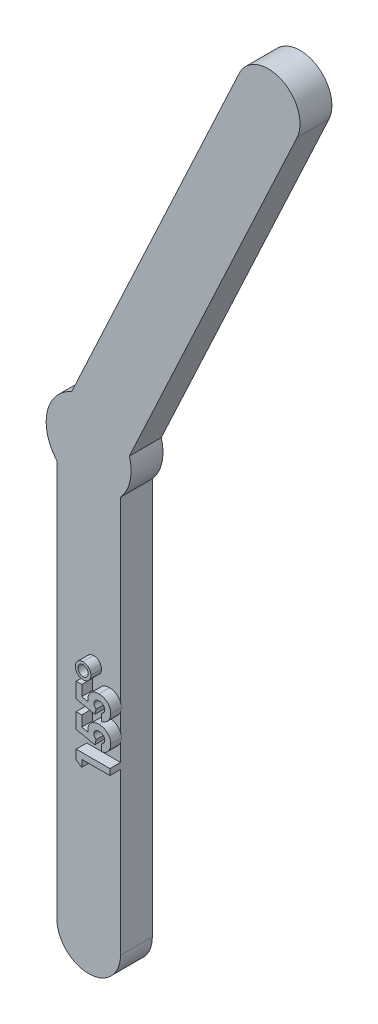
from build123d import *

# Parameters (mm, degrees)
BOSS_EXTRUDE1_DEPTH = 3
BOSS_EXTRUDE2_DEPTH = 1


with BuildPart() as part:
    # Sketch2 → Boss-Extrude1 (new body)
    with BuildSketch(Plane.XY):
        with BuildLine():
            Line((-3, -40), (-3, -2.645751311))
            ThreePointArc((-3, -2.645751311), (-3.905184028, 0.865758456), (-1.600780541, 3.665719801))
            Line((-1.600780541, 3.665719801), (14.185807109, 37.520166267))
            ThreePointArc((14.185807109, 37.520166267), (18.172585255, 38.971234843), (19.623653831, 34.984456696))
            Line((19.623653831, 34.984456696), (3.837066181, 1.130010231))
            ThreePointArc((3.837066181, 1.130010231), (3.905184028, -0.865758456), (3, -2.645751311))
            Line((3, -2.645751311), (3, -40))
            ThreePointArc((3, -40), (0, -43), (-3, -40))
        make_face()
    extrude(amount=BOSS_EXTRUDE1_DEPTH)

    # Sketch3 → Boss-Extrude2 (add)
    # profile 1 of 4: a face of its own
    with BuildSketch(Plane.XY.offset(3)):
        Polygon((-0.175, -25.154881865), (-0.175, -24.27399745), (3, -24.27399745), (3, -24.843869245), (0.354166667, -24.843869245), (0.354166667, -25.495151297), align=None)
    # profile 2 of 4: a face of its own
    with BuildSketch(Plane.XY.offset(3)):
        with BuildLine():
            Line((-0.175, -22.666780904), (-0.175, -21.221112835))
            Line((-0.175, -21.221112835), (0.354166667, -21.221112835))
            Line((0.354166667, -21.221112835), (0.354166667, -22.215208388))
            Line((0.354166667, -22.215208388), (0.954567308, -22.339231825))
            add(Edge.make_bspline(
                [(0.954567308, -22.339231825), (0.949860453, -22.322331857), (0.940577569, -22.289001646), (0.93126801, -22.238789643), (0.92523385, -22.190127214), (0.924428974, -22.158195225), (0.924038462, -22.142702378)],
                knots=[0, 0, 0, 0, 1.05461699, 2.079921384, 3.068411212, 4, 4, 4, 4], degree=3))
            add(Edge.make_bspline(
                [(0.924038462, -22.142702378), (0.924812065, -22.108941843), (0.926337007, -22.042392392), (0.940813682, -21.945038989), (0.963614006, -21.851817354), (0.996131972, -21.763012757), (1.038454945, -21.678711946), (1.089653878, -21.598812734), (1.149818696, -21.523217057), (1.218987066, -21.453267813), (1.294935502, -21.388995525), (1.377081772, -21.333114437), (1.46425455, -21.2853885), (1.5569957, -21.24742894), (1.654722746, -21.217468019), (1.757498313, -21.195817589), (1.865444205, -21.183014608), (1.93908797, -21.181288204), (1.976647636, -21.180407707)],
                knots=[0, 0, 0, 0, 1.01440847, 1.999622559, 2.951875003, 3.895578053, 4.836219714, 5.782137149, 6.743708247, 7.735272588, 8.734977101, 9.730283169, 10.717124674, 11.717316708, 12.737475749, 13.78628267, 14.87096371, 16, 16, 16, 16], degree=3))
            add(Edge.make_bspline(
                [(1.976647636, -21.180407707), (2.014633256, -21.181484562), (2.089589988, -21.183609511), (2.199810405, -21.197449086), (2.305347887, -21.221944103), (2.406436844, -21.255299747), (2.502206798, -21.300127262), (2.594432718, -21.35251873), (2.681133664, -21.416274008), (2.762568124, -21.488310549), (2.837049691, -21.566942096), (2.902401087, -21.650872227), (2.958366099, -21.738692377), (3.002753164, -21.831645035), (3.038048148, -21.928308639), (3.063686875, -22.02901873), (3.078401729, -22.134209728), (3.080396394, -22.205622789), (3.081410256, -22.241921128)],
                knots=[0, 0, 0, 0, 1.068214675, 2.107899807, 3.117335077, 4.110871058, 5.095206435, 6.086091645, 7.088956472, 8.115291905, 9.140102477, 10.129911027, 11.102477109, 12.062389472, 13.02046727, 13.992137592, 14.979429371, 16, 16, 16, 16], degree=3))
            add(Edge.make_bspline(
                [(3.081410256, -22.241921128), (3.080553487, -22.274375201), (3.078863759, -22.338381424), (3.069191791, -22.432809959), (3.049983355, -22.523374152), (3.025867721, -22.610966919), (2.992625683, -22.694377224), (2.954425098, -22.775323862), (2.90646499, -22.851370059), (2.853629949, -22.924676252), (2.793625688, -22.99242431), (2.728785352, -23.055326412), (2.657896897, -23.110989807), (2.582338125, -23.161488315), (2.500698196, -23.204078201), (2.414445642, -23.24215109), (2.322609586, -23.273254415), (2.258952506, -23.289048145), (2.226602564, -23.297074373)],
                knots=[0, 0, 0, 0, 1.055144606, 2.080965977, 3.079696235, 4.061281178, 5.030010203, 5.994686618, 6.966205752, 7.947572972, 8.929036963, 9.903776773, 10.879904045, 11.854643856, 12.853445432, 13.868704235, 14.916895142, 16, 16, 16, 16], degree=3))
            Line((2.226602564, -23.297074373), (2.226602564, -22.645792322))
            add(Edge.make_bspline(
                [(2.226602564, -22.645792322), (2.2490257, -22.633890657), (2.292602504, -22.610761129), (2.350368396, -22.566697457), (2.399871513, -22.517706852), (2.440196073, -22.462990061), (2.472150078, -22.404363647), (2.495375872, -22.342123636), (2.509002642, -22.276645978), (2.510687604, -22.232019375), (2.511538462, -22.209484229)],
                knots=[0, 0, 0, 0, 1.10506944, 2.147576346, 3.153981456, 4.13180336, 5.099527609, 6.055753385, 7.01821161, 8, 8, 8, 8], degree=3))
            add(Edge.make_bspline(
                [(2.511538462, -22.209484229), (2.510947576, -22.193779489), (2.509785, -22.162880149), (2.50363468, -22.117354857), (2.491986113, -22.073898966), (2.475855555, -22.032189391), (2.455738928, -21.99211409), (2.430342997, -21.954247557), (2.401111339, -21.917930981), (2.367567912, -21.883717249), (2.330174793, -21.852729469), (2.289993338, -21.825556576), (2.247916387, -21.801260262), (2.202277167, -21.783263611), (2.154438481, -21.768525876), (2.104039466, -21.757672411), (2.051021262, -21.751186242), (2.01482722, -21.750585797), (1.996364183, -21.750279502)],
                knots=[0, 0, 0, 0, 0.978869489, 1.925942215, 2.855067702, 3.774946051, 4.70828698, 5.642468714, 6.60995405, 7.609372294, 8.622401667, 9.629904756, 10.629323, 11.642352373, 12.678539694, 13.745912462, 14.850161547, 16, 16, 16, 16], degree=3))
            add(Edge.make_bspline(
                [(1.996364183, -21.750279502), (1.978329715, -21.750634992), (1.943225185, -21.751326963), (1.891679164, -21.75705109), (1.842771306, -21.767291433), (1.796127073, -21.781244015), (1.752029496, -21.799104896), (1.71021687, -21.820932409), (1.670897628, -21.846818339), (1.634883088, -21.87690712), (1.601818883, -21.908977582), (1.573009836, -21.943488611), (1.548770358, -21.979789149), (1.528965852, -22.017812034), (1.512557035, -22.057208794), (1.502358941, -22.098868281), (1.494574966, -22.141777012), (1.494134135, -22.171073314), (1.493910256, -22.185951577)],
                knots=[0, 0, 0, 0, 1.166353127, 2.270334681, 3.348811111, 4.394351869, 5.415506664, 6.421447184, 7.440758738, 8.453871, 9.452682422, 10.416618495, 11.356052082, 12.270018172, 13.186757755, 14.10810127, 15.039190426, 16, 16, 16, 16], degree=3))
            add(Edge.make_bspline(
                [(1.493910256, -22.185951577), (1.49450671, -22.202115732), (1.49570213, -22.234512166), (1.505940133, -22.282478076), (1.521093441, -22.330288573), (1.543719924, -22.377321674), (1.572750982, -22.424019708), (1.607825567, -22.470463061), (1.6495043, -22.516463862), (1.680674523, -22.545529416), (1.69679988, -22.56056596)],
                knots=[0, 0, 0, 0, 0.882519632, 1.768758668, 2.670168731, 3.618680561, 4.612333577, 5.671392632, 6.795336641, 8, 8, 8, 8], degree=3))
            Line((1.69679988, -22.56056596), (1.58676883, -23.040123252))
            Line((1.58676883, -23.040123252), (-0.175, -22.666780904))
        make_face()
    # profile 3 of 4: a face of its own
    with BuildSketch(Plane.XY.offset(3)):
        with BuildLine():
            Line((-0.175, -20.183768083), (-0.175, -18.738100015))
            Line((-0.175, -18.738100015), (0.354166667, -18.738100015))
            Line((0.354166667, -18.738100015), (0.354166667, -19.732195567))
            Line((0.354166667, -19.732195567), (0.954567308, -19.856219005))
            add(Edge.make_bspline(
                [(0.954567308, -19.856219005), (0.949860453, -19.839319036), (0.940577569, -19.805988826), (0.93126801, -19.755776822), (0.92523385, -19.707114393), (0.924428974, -19.675182404), (0.924038462, -19.659689558)],
                knots=[0, 0, 0, 0, 1.05461699, 2.079921384, 3.068411212, 4, 4, 4, 4], degree=3))
            add(Edge.make_bspline(
                [(0.924038462, -19.659689558), (0.924812065, -19.625929023), (0.926337007, -19.559379571), (0.940813682, -19.462026168), (0.963614006, -19.368804534), (0.996131972, -19.279999936), (1.038454945, -19.195699126), (1.089653878, -19.115799914), (1.149818696, -19.040204237), (1.218987066, -18.970254992), (1.294935502, -18.905982705), (1.377081772, -18.850101616), (1.46425455, -18.80237568), (1.5569957, -18.76441612), (1.654722746, -18.734455199), (1.757498313, -18.712804768), (1.865444205, -18.700001787), (1.93908797, -18.698275384), (1.976647636, -18.697394886)],
                knots=[0, 0, 0, 0, 1.01440847, 1.999622559, 2.951875003, 3.895578053, 4.836219714, 5.782137149, 6.743708247, 7.735272588, 8.734977101, 9.730283169, 10.717124674, 11.717316708, 12.737475749, 13.78628267, 14.87096371, 16, 16, 16, 16], degree=3))
            add(Edge.make_bspline(
                [(1.976647636, -18.697394886), (2.014633256, -18.698471741), (2.089589988, -18.700596691), (2.199810405, -18.714436265), (2.305347887, -18.738931282), (2.406436844, -18.772286927), (2.502206798, -18.817114441), (2.594432718, -18.86950591), (2.681133664, -18.933261188), (2.762568124, -19.005297728), (2.837049691, -19.083929276), (2.902401087, -19.167859406), (2.958366099, -19.255679557), (3.002753164, -19.348632215), (3.038048148, -19.445295819), (3.063686875, -19.546005909), (3.078401729, -19.651196908), (3.080396394, -19.722609968), (3.081410256, -19.758908308)],
                knots=[0, 0, 0, 0, 1.068214675, 2.107899807, 3.117335077, 4.110871058, 5.095206435, 6.086091645, 7.088956472, 8.115291905, 9.140102477, 10.129911027, 11.102477109, 12.062389472, 13.02046727, 13.992137592, 14.979429371, 16, 16, 16, 16], degree=3))
            add(Edge.make_bspline(
                [(3.081410256, -19.758908308), (3.080553487, -19.79136238), (3.078863759, -19.855368603), (3.069191791, -19.949797139), (3.049983355, -20.040361332), (3.025867721, -20.127954099), (2.992625683, -20.211364404), (2.954425098, -20.292311041), (2.90646499, -20.368357239), (2.853629949, -20.441663431), (2.793625688, -20.50941149), (2.728785352, -20.572313591), (2.657896897, -20.627976986), (2.582338125, -20.678475495), (2.500698196, -20.721065381), (2.414445642, -20.75913827), (2.322609586, -20.790241595), (2.258952506, -20.806035325), (2.226602564, -20.814061553)],
                knots=[0, 0, 0, 0, 1.055144606, 2.080965977, 3.079696235, 4.061281178, 5.030010203, 5.994686618, 6.966205752, 7.947572972, 8.929036963, 9.903776773, 10.879904045, 11.854643856, 12.853445432, 13.868704235, 14.916895142, 16, 16, 16, 16], degree=3))
            Line((2.226602564, -20.814061553), (2.226602564, -20.162779502))
            add(Edge.make_bspline(
                [(2.226602564, -20.162779502), (2.2490257, -20.150877837), (2.292602504, -20.127748308), (2.350368396, -20.083684636), (2.399871513, -20.034694032), (2.440196073, -19.979977241), (2.472150078, -19.921350826), (2.495375872, -19.859110815), (2.509002642, -19.793633158), (2.510687604, -19.749006554), (2.511538462, -19.726471409)],
                knots=[0, 0, 0, 0, 1.10506944, 2.147576346, 3.153981456, 4.13180336, 5.099527609, 6.055753385, 7.01821161, 8, 8, 8, 8], degree=3))
            add(Edge.make_bspline(
                [(2.511538462, -19.726471409), (2.510947576, -19.710766669), (2.509785, -19.679867328), (2.50363468, -19.634342036), (2.491986113, -19.590886145), (2.475855555, -19.54917657), (2.455738928, -19.509101269), (2.430342997, -19.471234736), (2.401111339, -19.434918161), (2.367567912, -19.400704428), (2.330174793, -19.369716649), (2.289993338, -19.342543756), (2.247916387, -19.318247442), (2.202277167, -19.300250791), (2.154438481, -19.285513055), (2.104039466, -19.274659591), (2.051021262, -19.268173422), (2.01482722, -19.267572976), (1.996364183, -19.267266681)],
                knots=[0, 0, 0, 0, 0.978869489, 1.925942215, 2.855067702, 3.774946051, 4.70828698, 5.642468714, 6.60995405, 7.609372294, 8.622401667, 9.629904756, 10.629323, 11.642352373, 12.678539694, 13.745912462, 14.850161547, 16, 16, 16, 16], degree=3))
            add(Edge.make_bspline(
                [(1.996364183, -19.267266681), (1.978329715, -19.267622172), (1.943225185, -19.268314143), (1.891679164, -19.274038269), (1.842771306, -19.284278613), (1.796127073, -19.298231195), (1.752029496, -19.316092075), (1.71021687, -19.337919589), (1.670897628, -19.363805519), (1.634883088, -19.393894299), (1.601818883, -19.425964762), (1.573009836, -19.46047579), (1.548770358, -19.496776329), (1.528965852, -19.534799214), (1.512557035, -19.574195974), (1.502358941, -19.61585546), (1.494574966, -19.658764191), (1.494134135, -19.688060493), (1.493910256, -19.702938756)],
                knots=[0, 0, 0, 0, 1.166353127, 2.270334681, 3.348811111, 4.394351869, 5.415506664, 6.421447184, 7.440758738, 8.453871, 9.452682422, 10.416618495, 11.356052082, 12.270018172, 13.186757755, 14.10810127, 15.039190426, 16, 16, 16, 16], degree=3))
            add(Edge.make_bspline(
                [(1.493910256, -19.702938756), (1.49450671, -19.719102911), (1.49570213, -19.751499345), (1.505940133, -19.799465256), (1.521093441, -19.847275752), (1.543719924, -19.894308853), (1.572750982, -19.941006888), (1.607825567, -19.98745024), (1.6495043, -20.033451041), (1.680674523, -20.062516595), (1.69679988, -20.07755314)],
                knots=[0, 0, 0, 0, 0.882519632, 1.768758668, 2.670168731, 3.618680561, 4.612333577, 5.671392632, 6.795336641, 8, 8, 8, 8], degree=3))
            Line((1.69679988, -20.07755314), (1.58676883, -20.557110431))
            Line((1.58676883, -20.557110431), (-0.175, -20.183768083))
        make_face()
    # profile 4 of 4: a face of its own
    with BuildSketch(Plane.XY.offset(3)):
        with BuildLine():
            add(Edge.make_bspline(
                [(0.476282051, -16.824958989), (0.501543872, -16.825505484), (0.55122174, -16.826580176), (0.624352745, -16.837013476), (0.694208258, -16.854492691), (0.761803607, -16.876903338), (0.825395964, -16.908042089), (0.886396731, -16.944903837), (0.943669883, -16.989402672), (0.9978957, -17.039014969), (1.047295391, -17.093515132), (1.090947065, -17.151405488), (1.127096601, -17.212864468), (1.157366856, -17.276577248), (1.180332148, -17.343408663), (1.196689885, -17.412864586), (1.20741609, -17.485236986), (1.208449037, -17.534503871), (1.208974359, -17.559559349)],
                knots=[0, 0, 0, 0, 1.048753193, 2.062393874, 3.059725798, 4.03711221, 5.013824111, 5.993903926, 6.992478922, 8.020738441, 9.043061753, 10.043343452, 11.026424807, 11.999358773, 12.968420071, 13.955122655, 14.960044262, 16, 16, 16, 16], degree=3))
            add(Edge.make_bspline(
                [(1.208974359, -17.559559349), (1.208454225, -17.584616682), (1.207431478, -17.633887214), (1.196631189, -17.706233128), (1.180530583, -17.775855144), (1.156529218, -17.842391691), (1.126678292, -17.90615653), (1.090260147, -17.967072817), (1.046482503, -18.024600993), (0.996781055, -18.078582797), (0.942375086, -18.128107638), (0.88420218, -18.171482912), (0.823225465, -18.208946116), (0.758107997, -18.237837437), (0.69067286, -18.261947038), (0.619758864, -18.27798784), (0.545943315, -18.288833106), (0.495615647, -18.289833085), (0.469921875, -18.290343604)],
                knots=[0, 0, 0, 0, 1.037227242, 2.039512271, 3.023626077, 3.993053151, 4.963434463, 5.936395473, 6.927031705, 7.952593414, 8.972234493, 9.969891786, 10.954906455, 11.929570282, 12.915563215, 13.916770353, 14.936449251, 16, 16, 16, 16], degree=3))
            add(Edge.make_bspline(
                [(0.469921875, -18.290343604), (0.445290866, -18.289811451), (0.396869022, -18.288765297), (0.325492116, -18.278103661), (0.256787066, -18.261182775), (0.190979117, -18.23681523), (0.128167681, -18.205730248), (0.067236284, -18.169180135), (0.010175979, -18.123937412), (-0.044275745, -18.073515722), (-0.093962638, -18.018218509), (-0.137555056, -17.95952238), (-0.173973759, -17.89802202), (-0.203993097, -17.834134423), (-0.227847104, -17.767768562), (-0.244158222, -17.698411219), (-0.254789074, -17.626671533), (-0.255866772, -17.577830012), (-0.256410256, -17.553199173)],
                knots=[0, 0, 0, 0, 1.027628768, 2.020204677, 3.0054932, 3.977172113, 4.942988595, 5.928118098, 6.937247537, 7.976812879, 9.023474825, 10.036014018, 11.024160528, 12.002107364, 12.979092523, 13.962271943, 14.972371232, 16, 16, 16, 16], degree=3))
            add(Edge.make_bspline(
                [(-0.256410256, -17.553199173), (-0.255881051, -17.528566172), (-0.254836181, -17.479930408), (-0.244068832, -17.408427146), (-0.227959354, -17.339440503), (-0.203981879, -17.27352423), (-0.173948227, -17.210285117), (-0.137706982, -17.149501332), (-0.093944483, -17.091941849), (-0.043999627, -17.038019265), (0.009956511, -16.987787182), (0.068273488, -16.944627592), (0.128824771, -16.907104674), (0.192846684, -16.877455064), (0.259342082, -16.853394895), (0.329176204, -16.837233977), (0.401748506, -16.826543556), (0.451226198, -16.825491671), (0.476282051, -16.824958989)],
                knots=[0, 0, 0, 0, 1.02774298, 2.029191086, 3.012479778, 3.981238486, 4.951290381, 5.931946007, 6.930416638, 7.964088953, 8.997761269, 10.003308488, 10.98854748, 11.966603007, 12.943696749, 13.935593372, 14.954569896, 16, 16, 16, 16], degree=3))
        make_face()
        with BuildLine():
            add(Edge.make_bspline(
                [(0.479462139, -17.069189758), (0.462471258, -17.069424264), (0.428972226, -17.069886612), (0.379883793, -17.077505977), (0.332524379, -17.088023775), (0.287283463, -17.10328392), (0.24427911, -17.123234284), (0.203398935, -17.147571829), (0.164484674, -17.176174899), (0.128492582, -17.209237523), (0.095853701, -17.245103846), (0.066652511, -17.282897251), (0.042455186, -17.323086522), (0.023016589, -17.365273093), (0.006315159, -17.408801858), (-0.003707976, -17.454711924), (-0.01154919, -17.502263298), (-0.011966436, -17.534718897), (-0.012179487, -17.55129112)],
                knots=[0, 0, 0, 0, 1.061159961, 2.092171217, 3.098605391, 4.092036902, 5.070589041, 6.057187883, 7.061962211, 8.084674938, 9.107387665, 10.090954379, 11.06617917, 12.032717429, 12.99305519, 13.973669989, 14.965331307, 16, 16, 16, 16], degree=3))
            add(Edge.make_bspline(
                [(-0.012179487, -17.55129112), (-0.01157068, -17.568051412), (-0.01036426, -17.601263796), (-0.004409395, -17.650200831), (0.007572839, -17.69685371), (0.022606002, -17.742054962), (0.043122897, -17.784898142), (0.067542797, -17.826391236), (0.096744971, -17.865435361), (0.129769422, -17.902214665), (0.165718261, -17.935960463), (0.204573602, -17.964950546), (0.244977971, -17.990352408), (0.287582445, -18.010455361), (0.331832846, -18.026567734), (0.377821945, -18.038209426), (0.425871214, -18.044356322), (0.458458137, -18.045521173), (0.475010016, -18.046112835)],
                knots=[0, 0, 0, 0, 1.042034071, 2.064906527, 3.055369705, 4.030203466, 5.020228521, 6.000742353, 7.017744738, 8.043920206, 9.069249762, 10.075703201, 11.051782302, 12.029903876, 12.99669358, 13.974371501, 14.971122288, 16, 16, 16, 16], degree=3))
            add(Edge.make_bspline(
                [(0.475010016, -18.046112835), (0.491349767, -18.045520146), (0.523514051, -18.044353455), (0.570936909, -18.038223162), (0.616468237, -18.026465839), (0.660506807, -18.010425399), (0.703332854, -17.990458383), (0.743356347, -17.964229259), (0.782721478, -17.935019181), (0.819574977, -17.900938323), (0.853594861, -17.864058718), (0.883277913, -17.824563201), (0.908722399, -17.783622403), (0.929101491, -17.740636346), (0.945194342, -17.696373754), (0.956841315, -17.650387952), (0.962986781, -17.60233779), (0.964151827, -17.56975099), (0.96474359, -17.553199173)],
                knots=[0, 0, 0, 0, 1.017878107, 2.003660885, 2.970612419, 3.939454555, 4.919652619, 5.904816436, 6.913406512, 7.969270601, 9.02513469, 10.033724766, 11.041277553, 12.021475617, 12.990317753, 13.970071221, 14.968938047, 16, 16, 16, 16], degree=3))
            add(Edge.make_bspline(
                [(0.96474359, -17.553199173), (0.964515736, -17.536840687), (0.964066668, -17.504600367), (0.956359019, -17.457448889), (0.946146284, -17.411789288), (0.929505189, -17.368485652), (0.910263551, -17.326033898), (0.884925795, -17.286252494), (0.856415485, -17.247396305), (0.822504018, -17.212069657), (0.787116244, -17.177952839), (0.747777121, -17.149765554), (0.707718654, -17.124520148), (0.665616684, -17.10387006), (0.621397497, -17.089062601), (0.575848465, -17.07693948), (0.528165265, -17.071009446), (0.49579822, -17.069800121), (0.479462139, -17.069189758)],
                knots=[0, 0, 0, 0, 1.029744634, 2.029484694, 3.00508751, 3.97324883, 4.947661161, 5.937798898, 6.940036528, 7.980134083, 9.020231638, 10.033191535, 11.023329272, 12.003497406, 12.979740652, 13.958541426, 14.969648588, 16, 16, 16, 16], degree=3))
        make_face(mode=Mode.SUBTRACT)
    extrude(amount=BOSS_EXTRUDE2_DEPTH)


solid = part.part
